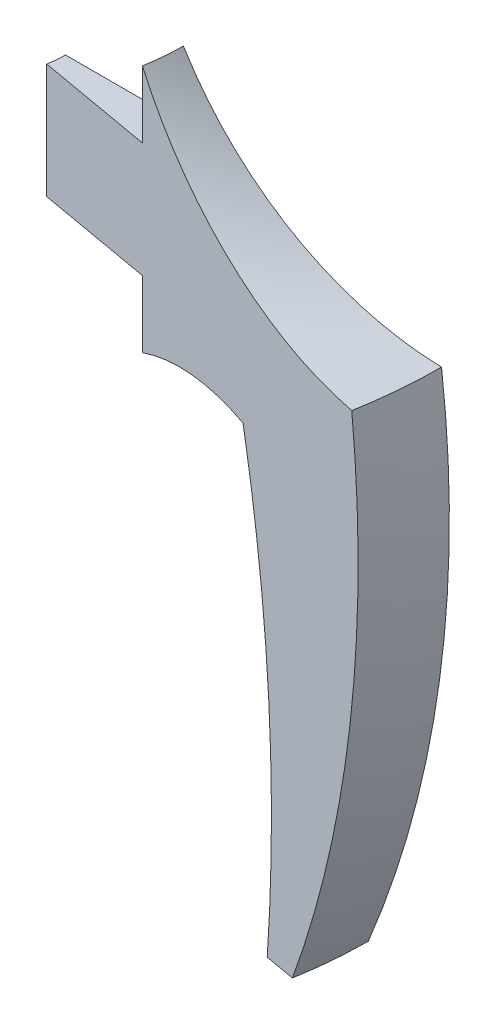
from build123d import *

# Parameters (mm, degrees)
REVOLVE1_ANGLE = 10


with BuildPart() as part:
    # Sketch2 → Revolve1 (revolve)
    with BuildSketch(Plane.XY):
        with BuildLine():
            ThreePointArc((55, -18.250226729), (44.849284803, -17.402430783), (35, -20))
            Line((35, -20), (35, 20))
            ThreePointArc((35, 20), (52.721414573, 2.677196604), (76.584109665, -4.008596909))
            ThreePointArc((76.584109665, -4.008596909), (76.270130447, -47.769342724), (64.795242944, -90))
            Line((64.795242944, -90), (59.795242944, -90))
            ThreePointArc((59.795242944, -90), (60.100118063, -53.944497774), (55, -18.250226729))
        make_face()
        Polygon((16, -9.25), (35, -9.25), (35, 9.25), (16, 9.25), (16, 0), align=None)
    revolve(axis=Axis((0, 0, 0), (0, -1, 0)), revolution_arc=REVOLVE1_ANGLE)


solid = part.part
